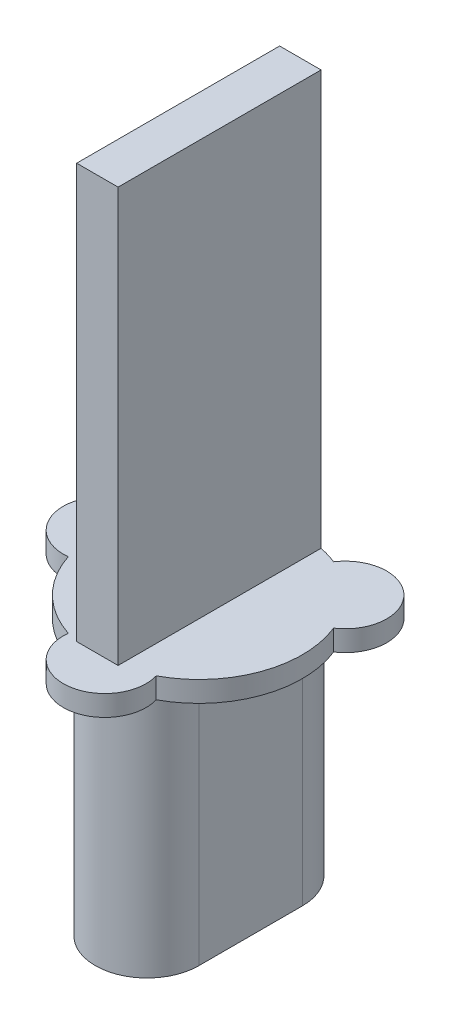
from build123d import *

# Parameters (mm, degrees)
BOSS_EXTRUDE1_DEPTH = 13
BOSS_EXTRUDE2_DEPTH = 1
SKETCH1_5_W         = 2
SKETCH1_5_H         = 9.797958972
BOSS_EXTRUDE3_DEPTH = 20


with BuildPart() as part:
    # Sketch1 → Boss-Extrude1 (new body)
    with BuildSketch(Plane(origin=(0, 0, 0), x_dir=(1, 0, 0), z_dir=(0, 1, 0))):
        with BuildLine():
            Line((2.5, 2.5), (2.5, -2.5))
            ThreePointArc((2.5, -2.5), (0, -5), (-2.5, -2.5))
            Line((-2.5, -2.5), (-2.5, 2.5))
            ThreePointArc((-2.5, 2.5), (0, 5), (2.5, 2.5))
        make_face()
    extrude(amount=-BOSS_EXTRUDE1_DEPTH)

    # Sketch1<3> → Boss-Extrude2 (add)
    with BuildSketch(Plane(origin=(0, 0, 0), x_dir=(1, 0, 0), z_dir=(0, 1, 0))):
        with BuildLine():
            ThreePointArc((1.867050547, 4.63833184), (-1.710100717, 4.698463104), (-4.411705933, 2.353051372))
            ThreePointArc((-4.411705933, 2.353051372), (-6.973362887, 0.610090199), (-4.75328529, -1.551218539))
            ThreePointArc((-4.75328529, -1.551218539), (-3.535533906, -3.535533906), (-1.551218539, -4.75328529))
            ThreePointArc((-1.551218539, -4.75328529), (0.610090199, -6.973362887), (2.353051372, -4.411705933))
            ThreePointArc((2.353051372, -4.411705933), (4.698463104, -1.710100717), (4.63833184, 1.867050547))
            ThreePointArc((4.63833184, 1.867050547), (4.949747468, 4.949747468), (1.867050547, 4.63833184))
        make_face()
    extrude(amount=-BOSS_EXTRUDE2_DEPTH)

    # Sketch1<5> → Boss-Extrude3 (add)
    with BuildSketch(Plane(origin=(0, 0, 0), x_dir=(1, 0, 0), z_dir=(0, 1, 0))):
        Rectangle(SKETCH1_5_W, SKETCH1_5_H)
    extrude(amount=BOSS_EXTRUDE3_DEPTH)


solid = part.part
